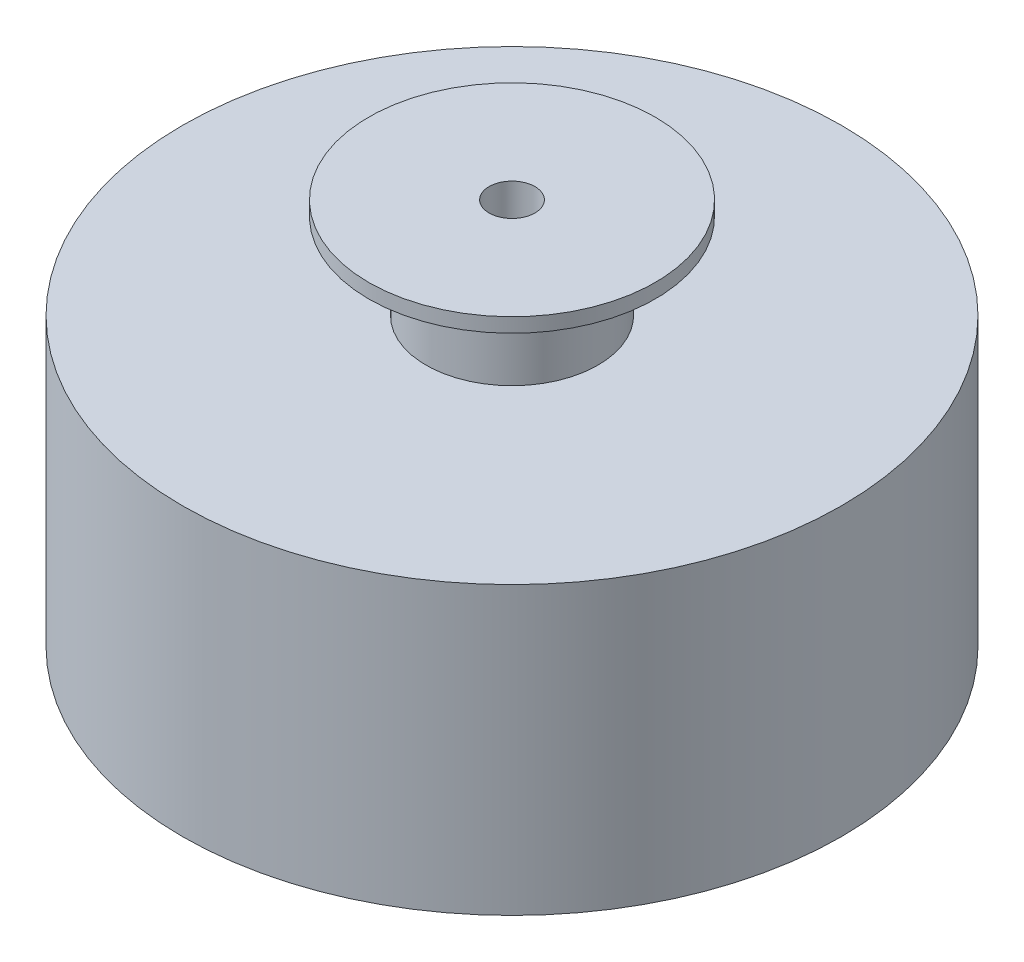
from build123d import *


with BuildPart() as part:
    # Sketch1 → Revolve1 (revolve)
    with BuildSketch(Plane(origin=(0, 0, 0), x_dir=(0, 0, -1), z_dir=(1, 0, 0)), mode=Mode.PRIVATE) as revolve1_sk:
        Polygon((-30, 80), (-50, 80), (-50, 85), (-8, 85), (-8, -85), (-50, -85), (-50, -80), (-30, -80), (-30, -50), (-115, -50), (-115, 50), (-30, 50), align=None)
    revolve(revolve1_sk.sketch.rotate(Axis((0, -5577.839151729, 0), (0, 1, 0)), 180), axis=Axis((0, -5577.839151729, 0), (0, 1, 0)))


solid = part.part
